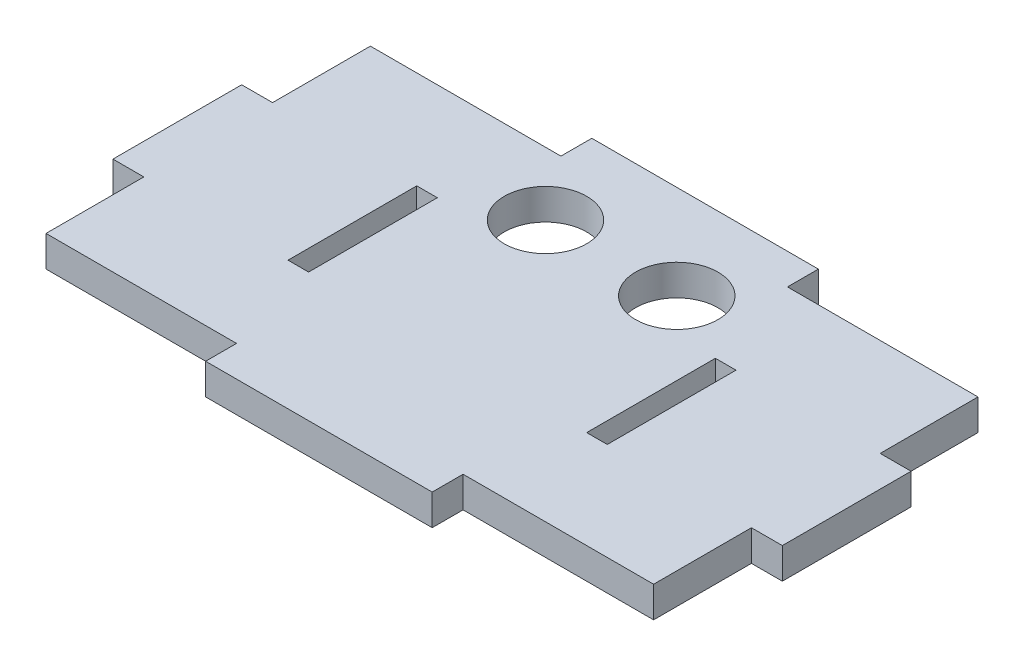
from build123d import *

# Parameters (mm, degrees)
SKETCH1_W           = 130
SKETCH1_H           = 75
BOSS_EXTRUDE1_DEPTH = 6
SKETCH2_R           = 8
CUT_EXTRUDE1_DEPTH  = 6
SKETCH3_W           = 4
SKETCH3_H           = 25
CUT_EXTRUDE2_DEPTH  = 151.203195705


with BuildPart() as part:
    # Sketch1 → Boss-Extrude1 (new body)
    with BuildSketch(Plane(origin=(0, 0, 0), x_dir=(1, 0, 0), z_dir=(0, 1, 0))):
        with Locations((65, 37.5)):
            Rectangle(SKETCH1_W, SKETCH1_H)
    extrude(amount=BOSS_EXTRUDE1_DEPTH)

    # Sketch2 → Cut-Extrude1 (cut)
    with BuildSketch(Plane(origin=(0, 6, 0), x_dir=(1, 0, 0), z_dir=(0, 1, 0))):
        with Locations(Location((52.25, 56.75, 0), (0, 0, 270))):
            Circle(SKETCH2_R)
        with Locations(Location((77.75, 56.75, 0), (0, 0, 270))):
            Circle(SKETCH2_R)
    extrude(amount=-CUT_EXTRUDE1_DEPTH, mode=Mode.SUBTRACT)

    # Sketch3 → Cut-Extrude2 (cut, through all)
    with BuildSketch(Plane(origin=(0, 6, 0), x_dir=(1, 0, 0), z_dir=(0, 1, 0))):
        Polygon((0, 0), (43, 0), (43, 6), (6, 6), (6, 25), (0, 25), align=None)
        Polygon((0, 50), (6, 50), (6, 69), (43, 69), (43, 75), (0, 75), align=None)
        with Locations((36, 37.5)):
            Rectangle(SKETCH3_W, SKETCH3_H)
        Polygon((87, 6), (87, 0), (130, 0), (130, 25), (124, 25), (124, 6), align=None)
        with Locations((94, 37.5)):
            Rectangle(SKETCH3_W, SKETCH3_H)
        Polygon((87, 75), (87, 69), (124, 69), (124, 50), (130, 50), (130, 75), align=None)
    extrude(amount=-CUT_EXTRUDE2_DEPTH, mode=Mode.SUBTRACT)


solid = part.part
